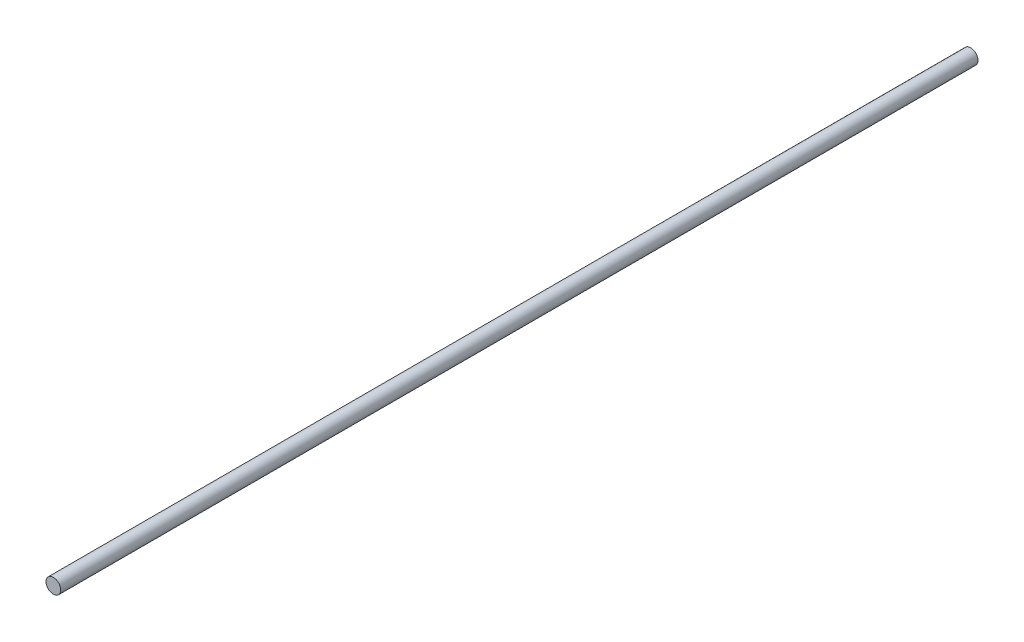
from build123d import *

# Parameters (mm, degrees)
SKETCH1_R           = 8
BOSS_EXTRUDE1_DEPTH = 1000


with BuildPart() as part:
    # Sketch1 → Boss-Extrude1 (new body)
    with BuildSketch(Plane.XY):
        Circle(SKETCH1_R)
    extrude(amount=-BOSS_EXTRUDE1_DEPTH)


solid = part.part
